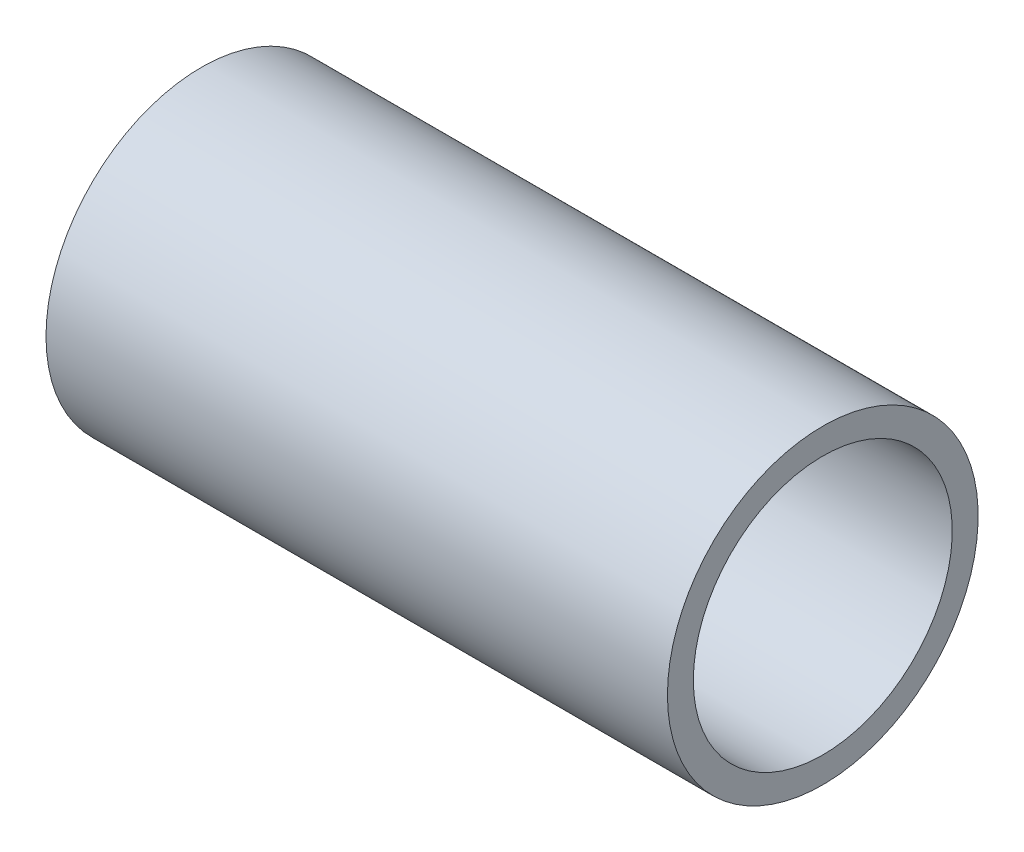
from build123d import *

# Parameters (mm, degrees)
SKETCH1_R           = 1.905
SKETCH1_R_2         = 1.5875
BOSS_EXTRUDE1_DEPTH = 7.62


with BuildPart() as part:
    # Sketch1 → Boss-Extrude1 (new body)
    with BuildSketch(Plane(origin=(0, 0, 0), x_dir=(0, 0, -1), z_dir=(1, 0, 0))):
        Circle(SKETCH1_R)
        Circle(SKETCH1_R_2, mode=Mode.SUBTRACT)
    extrude(amount=BOSS_EXTRUDE1_DEPTH)


solid = part.part
